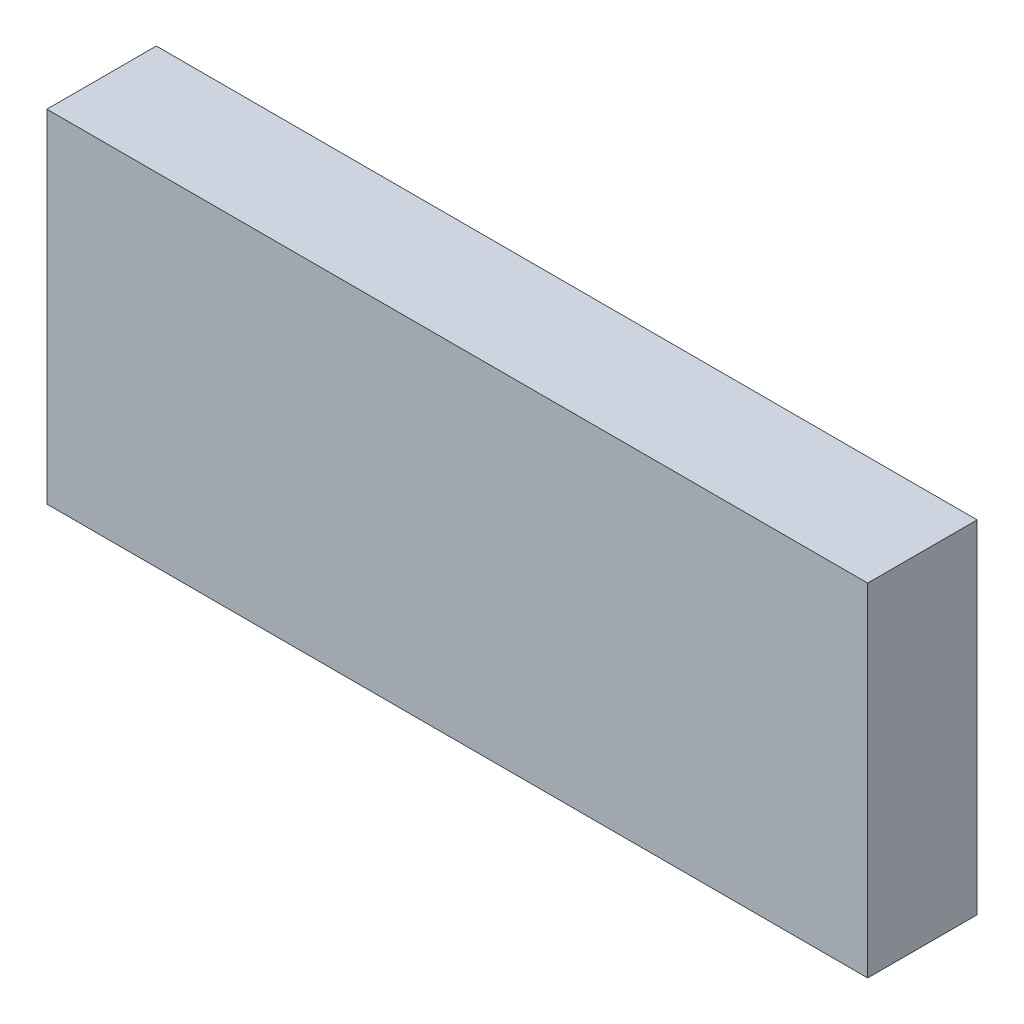
from build123d import *

# Parameters (mm, degrees)
SKETCH1_W           = 180
SKETCH1_H           = 75
BOSS_EXTRUDE1_DEPTH = 24


with BuildPart() as part:
    # Sketch1 → Boss-Extrude1 (new body)
    with BuildSketch(Plane.XY):
        Rectangle(SKETCH1_W, SKETCH1_H)
    extrude(amount=BOSS_EXTRUDE1_DEPTH)


solid = part.part
